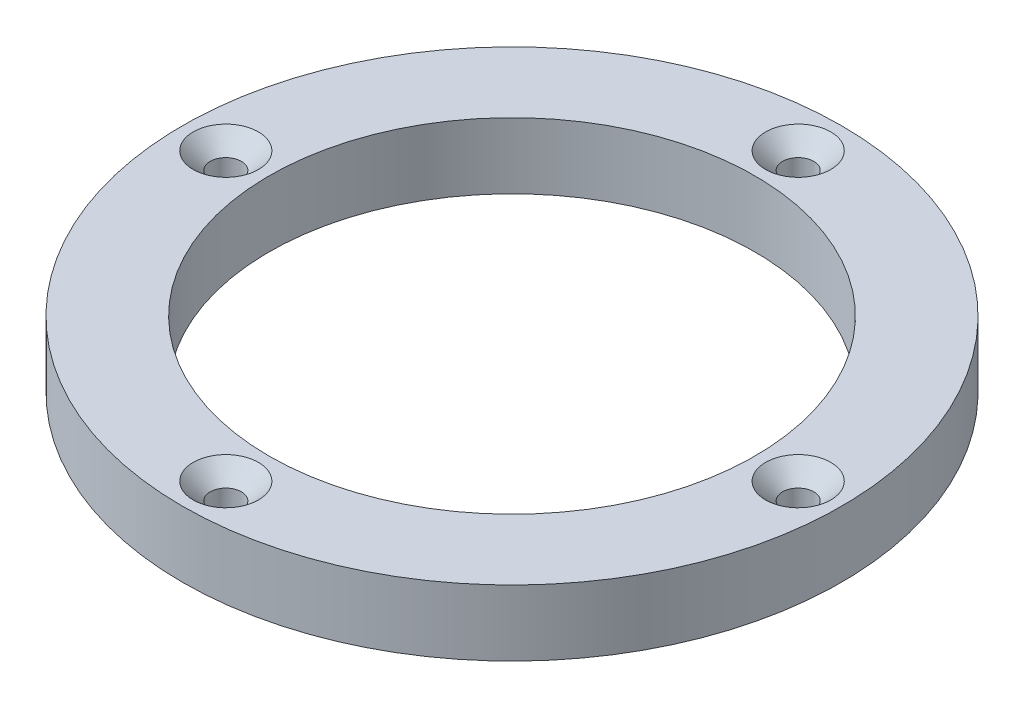
from build123d import *

# Parameters (mm, degrees)
SKETCH1_R                                           = 47.5
SKETCH1_R_2                                         = 35
BOSS_EXTRUDE1_DEPTH                                 = 9.5
SKETCH2_R                                           = 2.25
CUT_EXTRUDE1_DEPTH                                  = 10
CSK_FOR_M4_COUNTERSUNK_FLAT_HEAD_SCREW1_D           = 4.5
CSK_FOR_M4_COUNTERSUNK_FLAT_HEAD_SCREW1_CSINK_D     = 9.4
CSK_FOR_M4_COUNTERSUNK_FLAT_HEAD_SCREW1_CSINK_ANGLE = 90


with BuildPart() as part:
    # Sketch1 → Boss-Extrude1 (new body)
    with BuildSketch(Plane(origin=(0, 0, 0), x_dir=(1, 0, 0), z_dir=(0, 1, 0))):
        with Locations(Location((0, 0, 0), (0, 0, 270))):
            Circle(SKETCH1_R)
        with Locations(Location((0, 0, 0), (0, 0, 270))):
            Circle(SKETCH1_R_2, mode=Mode.SUBTRACT)
    extrude(amount=BOSS_EXTRUDE1_DEPTH)

    # Sketch2 → Cut-Extrude1 (cut)
    with BuildSketch(Plane(origin=(0, 9.5, 0), x_dir=(1, 0, 0), z_dir=(0, 1, 0))):
        with Locations(Location((0, 41.25, 0), (0, 0, 270))):
            Circle(SKETCH2_R)
        with Locations(Location((41.25, 0, 0), (0, 0, 270))):
            Circle(SKETCH2_R)
        with Locations(Location((0, -41.25, 0), (0, 0, 270))):
            Circle(SKETCH2_R)
        with Locations(Location((-41.25, 0, 0), (0, 0, 270))):
            Circle(SKETCH2_R)
    extrude(amount=-CUT_EXTRUDE1_DEPTH, mode=Mode.SUBTRACT)

    # CSK for M4 Countersunk Flat Head Screw1 (through all)
    with Locations(Plane(origin=(0, 9.5, 41.25), x_dir=(0, 0, 1), z_dir=(0, 1, 0))):
        with Locations((0, 0), (-41.25, 41.25), (-82.5, 0), (-41.25, -41.25)):
            CounterSinkHole(CSK_FOR_M4_COUNTERSUNK_FLAT_HEAD_SCREW1_D / 2, CSK_FOR_M4_COUNTERSUNK_FLAT_HEAD_SCREW1_CSINK_D / 2, counter_sink_angle=CSK_FOR_M4_COUNTERSUNK_FLAT_HEAD_SCREW1_CSINK_ANGLE)


solid = part.part
